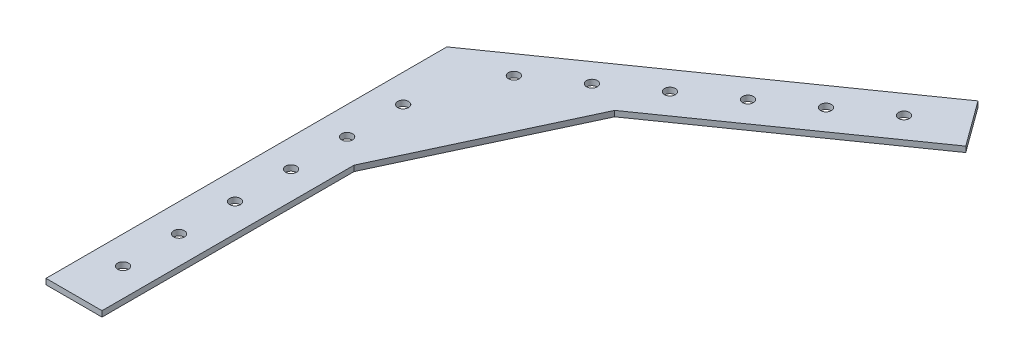
from build123d import *

# Parameters (mm, degrees)
BOSS_EXTRUDE1_DEPTH              = 1.27
F_10_0_1935_DIAMETER_HOLE2_D     = 4.9149
F_10_0_1935_DIAMETER_HOLE2_DEPTH = 50.8
F_10_0_1935_DIAMETER_HOLE2_TIP   = 1.476584928


with BuildPart() as part:
    # Sketch1 → Boss-Extrude1 (new, symmetric)
    with BuildSketch(Plane(origin=(0, 0, 0), x_dir=(1, 0, 0), z_dir=(0, 1, 0))):
        Polygon((-49.1324746, -114.072394731), (-23.7324746, -114.072394731), (-23.7324746, 0.227605269), (13.838288869, 80.798367536), (107.467367531, 146.358154211), (92.497603039, 166.878050679), (-49.1324746, 67.707602679), align=None)
    extrude(amount=BOSS_EXTRUDE1_DEPTH, both=True)

    # #10 (0.1935) Diameter Hole2
    with Locations(Plane(origin=(0, 1.27, 0), x_dir=(1, 0, 0), z_dir=(0, 1, 0))):
        with Locations((81.413587814, 144.4055404), (60.607125889, 129.836698916), (39.800663964, 115.267857433), (18.994202039, 100.69901595), (-1.812259886, 86.130174466), (-22.618721811, 71.561332983), (-36.4324746, 35.152605269), (-36.4324746, 9.752605269), (-36.4324746, -15.647394731), (-36.4324746, -41.047394731), (-36.4324746, -66.447394731), (-36.4324746, -91.847394731)):
            Hole(F_10_0_1935_DIAMETER_HOLE2_D / 2, depth=F_10_0_1935_DIAMETER_HOLE2_DEPTH)
            with Locations((0, 0, -(F_10_0_1935_DIAMETER_HOLE2_DEPTH + F_10_0_1935_DIAMETER_HOLE2_TIP / 2))):  # 118° drill point
                Cone(0, F_10_0_1935_DIAMETER_HOLE2_D / 2, F_10_0_1935_DIAMETER_HOLE2_TIP, mode=Mode.SUBTRACT)


solid = part.part
